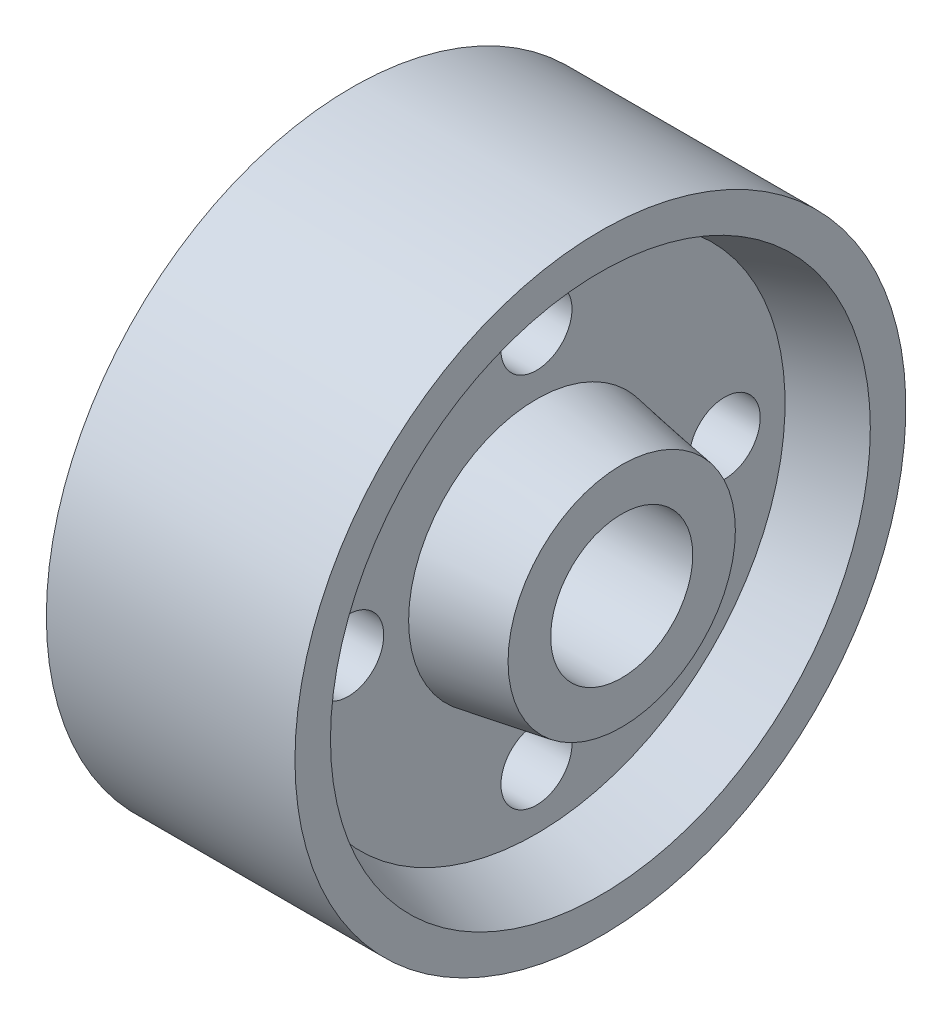
from build123d import *

# Parameters (mm, degrees)
SKETCH2_R          = 5
CUT_EXTRUDE2_DEPTH = 74.341666193
SKETCH3_R          = 10
CUT_EXTRUDE3_DEPTH = 74.341666193


with BuildPart() as part:
    # Sketch1 → Revolve1 (revolve)
    with BuildSketch(Plane(origin=(0, 0, 0), x_dir=(1, 0, 0), z_dir=(0, 1, 0)), mode=Mode.PRIVATE) as revolve1_sk:
        Polygon((0, 0), (0, 16), (12, 18), (12, 35), (3, 38), (3, 43), (38, 43), (38, 38), (29, 35), (29, 18), (41, 16), (41, 0), align=None)
    revolve(revolve1_sk.sketch.rotate(Axis((0, 0, 0), (1, 0, 0)), 180), axis=Axis((0, 0, 0), (1, 0, 0)))

    # Sketch2 → Cut-Extrude2 (cut, through all)
    with BuildSketch(Plane(origin=(41, 0, 0), x_dir=(0, 0, -1), z_dir=(1, 0, 0))):
        with Locations((0, 26.5)):
            Circle(SKETCH2_R)
        with Locations((26.5, 0)):
            Circle(SKETCH2_R)
        with Locations((0, -26.5)):
            Circle(SKETCH2_R)
        with Locations((-26.5, 0)):
            Circle(SKETCH2_R)
    extrude(amount=-CUT_EXTRUDE2_DEPTH, mode=Mode.SUBTRACT)

    # Sketch3 → Cut-Extrude3 (cut, through all)
    with BuildSketch(Plane(origin=(41, 0, 0), x_dir=(0, 0, -1), z_dir=(1, 0, 0))):
        Circle(SKETCH3_R)
    extrude(amount=-CUT_EXTRUDE3_DEPTH, mode=Mode.SUBTRACT)


solid = part.part
